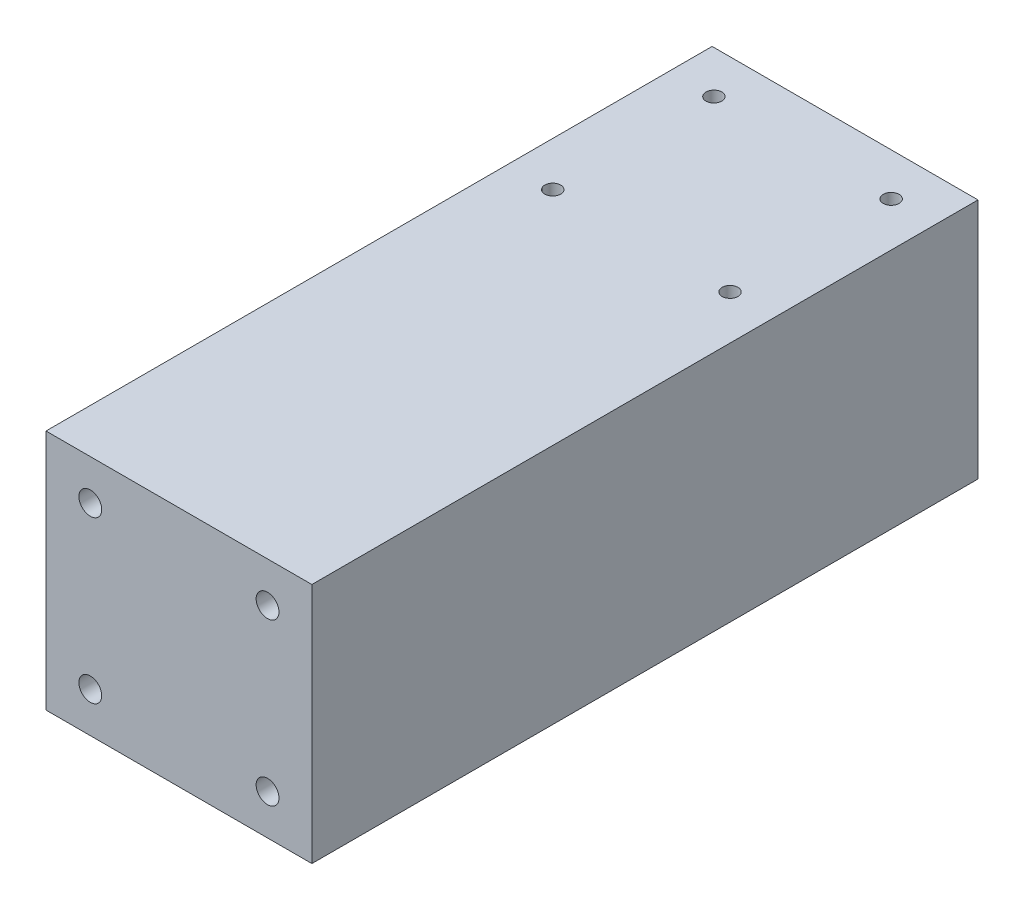
from build123d import *

# Parameters (mm, degrees)
SKETCH3_W                                           = 20.955
SKETCH3_H                                           = 38.1
BOSS_EXTRUDE1_DEPTH                                 = 5
CSK_FOR_M3_COUNTERSUNK_FLAT_HEAD_SCREW1_D           = 3.6
CSK_FOR_M3_COUNTERSUNK_FLAT_HEAD_SCREW1_DEPTH       = 10
CSK_FOR_M3_COUNTERSUNK_FLAT_HEAD_SCREW1_CSINK_D     = 6.3
CSK_FOR_M3_COUNTERSUNK_FLAT_HEAD_SCREW1_CSINK_ANGLE = 90
CSK_FOR_M3_COUNTERSUNK_FLAT_HEAD_SCREW1_TIP         = 1.081549114
CSK_FOR_M3_COUNTERSUNK_FLAT_HEAD_SCREW2_D           = 3.6
CSK_FOR_M3_COUNTERSUNK_FLAT_HEAD_SCREW2_DEPTH       = 10
CSK_FOR_M3_COUNTERSUNK_FLAT_HEAD_SCREW2_CSINK_D     = 6.3
CSK_FOR_M3_COUNTERSUNK_FLAT_HEAD_SCREW2_CSINK_ANGLE = 90
CSK_FOR_M3_COUNTERSUNK_FLAT_HEAD_SCREW2_TIP         = 1.081549114
SKETCH12_W                                          = 41.91
SKETCH12_H                                          = 38.1
BOSS_EXTRUDE2_DEPTH                                 = 100
SKETCH15_W                                          = 35.458687416
SKETCH15_H                                          = 32.541680012
CUT_EXTRUDE4_DEPTH                                  = 100
M3_TAPPED_HOLE1_D                                   = 2.5
M3_TAPPED_HOLE1_DEPTH                               = 10
M3_TAPPED_HOLE1_TIP                                 = 0.751075774


with BuildPart() as part:
    # Sketch3 → Boss-Extrude1 (new body)
    with BuildSketch(Plane.XY):
        with Locations((10.4775, -19.05)):
            Rectangle(SKETCH3_W, SKETCH3_H)
        with Locations((-10.4775, -19.05)):
            Rectangle(SKETCH3_W, SKETCH3_H)
    extrude(amount=BOSS_EXTRUDE1_DEPTH)

    # CSK for M3 Countersunk Flat Head Screw1
    with Locations(Plane(origin=(0, 0, 0), x_dir=(1, 0, 0), z_dir=(0, 0, -1))):
        with Locations((-13.97, 6.35)):
            CounterSinkHole(CSK_FOR_M3_COUNTERSUNK_FLAT_HEAD_SCREW1_D / 2, CSK_FOR_M3_COUNTERSUNK_FLAT_HEAD_SCREW1_CSINK_D / 2, depth=CSK_FOR_M3_COUNTERSUNK_FLAT_HEAD_SCREW1_DEPTH, counter_sink_angle=CSK_FOR_M3_COUNTERSUNK_FLAT_HEAD_SCREW1_CSINK_ANGLE)
            with Locations((0, 0, -(CSK_FOR_M3_COUNTERSUNK_FLAT_HEAD_SCREW1_DEPTH + CSK_FOR_M3_COUNTERSUNK_FLAT_HEAD_SCREW1_TIP / 2))):  # 118° drill point
                Cone(0, CSK_FOR_M3_COUNTERSUNK_FLAT_HEAD_SCREW1_D / 2, CSK_FOR_M3_COUNTERSUNK_FLAT_HEAD_SCREW1_TIP, mode=Mode.SUBTRACT)

    # CSK for M3 Countersunk Flat Head Screw2
    with Locations(Plane(origin=(0, 0, 0), x_dir=(1, 0, 0), z_dir=(0, 0, -1))):
        with Locations((-13.97, 31.75), (-13.97, 6.35), (13.97, 6.35), (13.97, 31.75)):
            CounterSinkHole(CSK_FOR_M3_COUNTERSUNK_FLAT_HEAD_SCREW2_D / 2, CSK_FOR_M3_COUNTERSUNK_FLAT_HEAD_SCREW2_CSINK_D / 2, depth=CSK_FOR_M3_COUNTERSUNK_FLAT_HEAD_SCREW2_DEPTH, counter_sink_angle=CSK_FOR_M3_COUNTERSUNK_FLAT_HEAD_SCREW2_CSINK_ANGLE)
            with Locations((0, 0, -(CSK_FOR_M3_COUNTERSUNK_FLAT_HEAD_SCREW2_DEPTH + CSK_FOR_M3_COUNTERSUNK_FLAT_HEAD_SCREW2_TIP / 2))):  # 118° drill point
                Cone(0, CSK_FOR_M3_COUNTERSUNK_FLAT_HEAD_SCREW2_D / 2, CSK_FOR_M3_COUNTERSUNK_FLAT_HEAD_SCREW2_TIP, mode=Mode.SUBTRACT)

    # Sketch12 → Boss-Extrude2 (add)
    with BuildSketch(Plane(origin=(0, 0, 0), x_dir=(-1, 0, 0), z_dir=(0, 0, -1))):
        with Locations((0, -19.05)):
            Rectangle(SKETCH12_W, SKETCH12_H)
    extrude(amount=BOSS_EXTRUDE2_DEPTH)

    # Sketch15 → Cut-Extrude4 (cut)
    with BuildSketch(Plane(origin=(0, 0, -100), x_dir=(-1, 0, 0), z_dir=(0, 0, -1))):
        with Locations((0, -18.974233574)):
            Rectangle(SKETCH15_W, SKETCH15_H)
    extrude(amount=-CUT_EXTRUDE4_DEPTH, mode=Mode.SUBTRACT)

    # M3 Tapped Hole1
    with Locations(Plane(origin=(0, 0, 0), x_dir=(1, 0, 0), z_dir=(0, 1, 0))):
        with Locations((-13.97, 93.295610143), (-13.97, 67.895610143), (13.97, 67.895610143), (13.97, 93.295610143)):
            Hole(M3_TAPPED_HOLE1_D / 2, depth=M3_TAPPED_HOLE1_DEPTH)
            with Locations((0, 0, -(M3_TAPPED_HOLE1_DEPTH + M3_TAPPED_HOLE1_TIP / 2))):  # 118° drill point
                Cone(0, M3_TAPPED_HOLE1_D / 2, M3_TAPPED_HOLE1_TIP, mode=Mode.SUBTRACT)


solid = part.part
